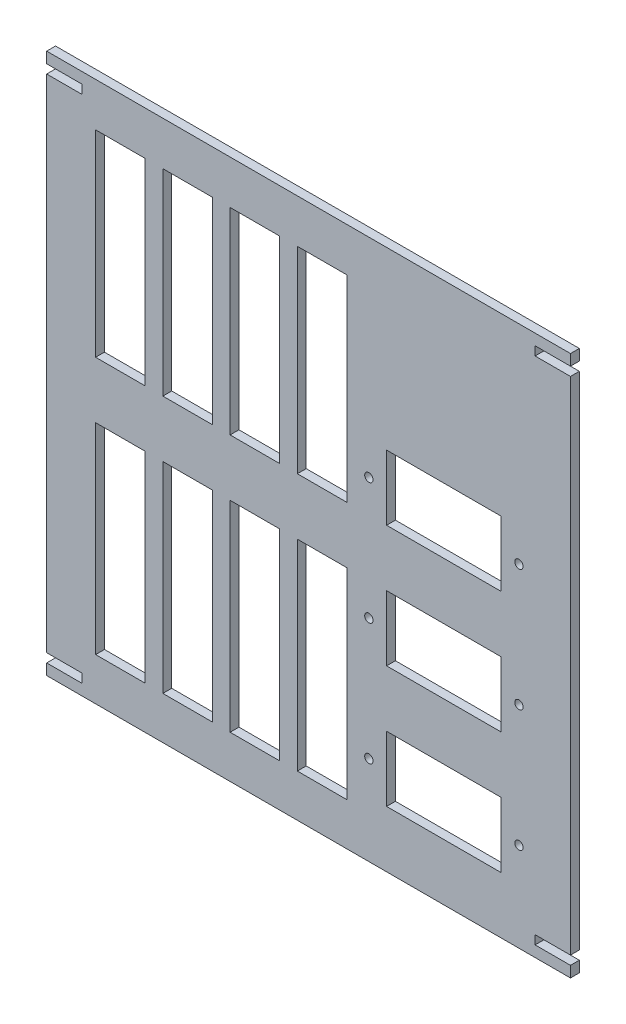
from build123d import *

# Parameters (mm, degrees)
SKETCH1_R           = 0.75
SKETCH1_W           = 20.574
SKETCH1_H           = 11.684
SKETCH1_W_2         = 8.89
SKETCH1_H_2         = 35.341542764
SKETCH1_H_3         = 36.036734061
BOSS_EXTRUDE1_DEPTH = 1.5875


with BuildPart() as part:
    # Sketch1 → Boss-Extrude1 (new body)
    with BuildSketch(Plane.XY):
        Polygon((0, 0), (93.98, 0), (93.98, 1.9685), (87.63, 1.9685), (87.63, 3.556), (93.98, 3.556), (93.98, 93.472), (87.63, 93.472), (87.63, 95.0595), (93.98, 95.0595), (93.98, 97.028), (0, 97.028), (0, 95.0595), (6.35, 95.0595), (6.35, 93.472), (0, 93.472), (0, 3.556), (6.35, 3.556), (6.35, 1.9685), (0, 1.9685), align=None)
        with Locations((57.807600894, 16.002)):
            Circle(SKETCH1_R, mode=Mode.SUBTRACT)
        with Locations((84.731600894, 16.002)):
            Circle(SKETCH1_R, mode=Mode.SUBTRACT)
        with Locations((57.807600894, 37.846)):
            Circle(SKETCH1_R, mode=Mode.SUBTRACT)
        with Locations((84.731600894, 37.846)):
            Circle(SKETCH1_R, mode=Mode.SUBTRACT)
        with Locations((57.807600894, 59.69)):
            Circle(SKETCH1_R, mode=Mode.SUBTRACT)
        with Locations((84.731600894, 59.69)):
            Circle(SKETCH1_R, mode=Mode.SUBTRACT)
        with Locations((71.269600894, 16.002)):
            Rectangle(SKETCH1_W, SKETCH1_H, mode=Mode.SUBTRACT)
        with Locations((71.269600894, 37.846)):
            Rectangle(SKETCH1_W, SKETCH1_H, mode=Mode.SUBTRACT)
        with Locations((71.269600894, 59.69)):
            Rectangle(SKETCH1_W, SKETCH1_H, mode=Mode.SUBTRACT)
        with Locations((25.290486919, 71.518771382)):
            Rectangle(SKETCH1_W_2, SKETCH1_H_2, mode=Mode.SUBTRACT)
        with Locations((13.225486919, 71.518771382)):
            Rectangle(SKETCH1_W_2, SKETCH1_H_2, mode=Mode.SUBTRACT)
        with Locations((13.225486919, 25.66963297)):
            Rectangle(SKETCH1_W_2, SKETCH1_H_3, mode=Mode.SUBTRACT)
        with Locations((25.290486919, 25.66963297)):
            Rectangle(SKETCH1_W_2, SKETCH1_H_3, mode=Mode.SUBTRACT)
        with Locations((37.355486919, 71.518771382)):
            Rectangle(SKETCH1_W_2, SKETCH1_H_2, mode=Mode.SUBTRACT)
        with Locations((37.355486919, 25.66963297)):
            Rectangle(SKETCH1_W_2, SKETCH1_H_3, mode=Mode.SUBTRACT)
        with Locations((49.420486919, 71.518771382)):
            Rectangle(SKETCH1_W_2, SKETCH1_H_2, mode=Mode.SUBTRACT)
        with Locations((49.420486919, 25.66963297)):
            Rectangle(SKETCH1_W_2, SKETCH1_H_3, mode=Mode.SUBTRACT)
    extrude(amount=BOSS_EXTRUDE1_DEPTH)


solid = part.part
